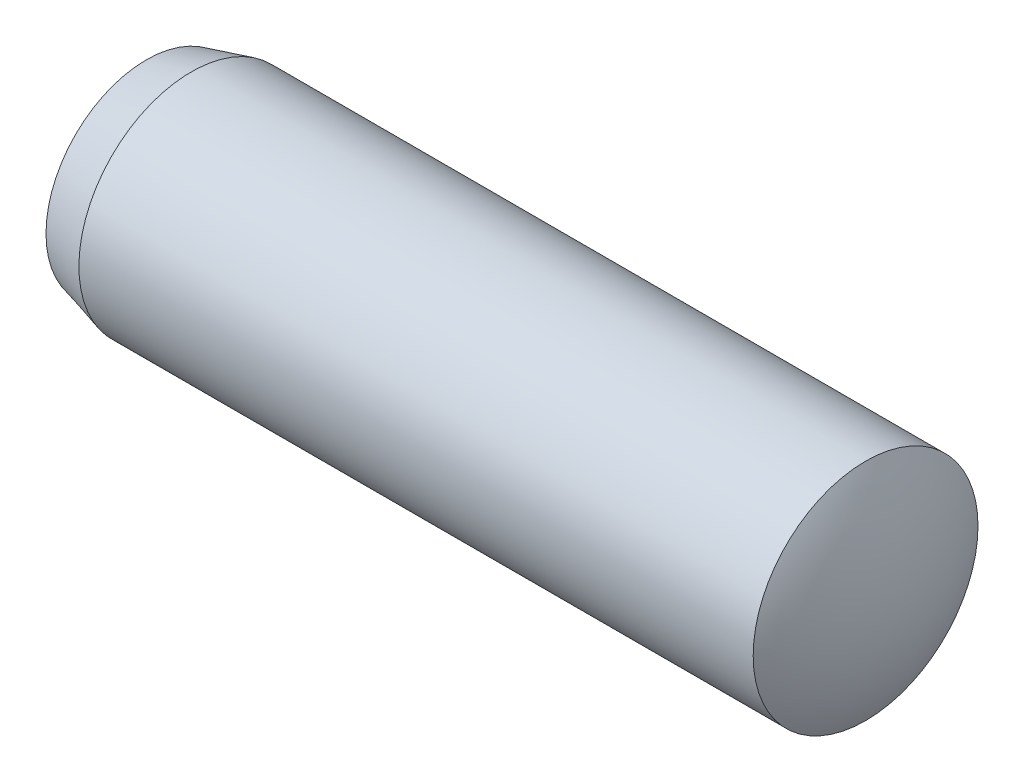
from build123d import *


with BuildPart() as part:
    # Skica1 → Otočit kolem osy1 (revolve)
    with BuildSketch(Plane.XY, mode=Mode.PRIVATE) as oto_it_kolem_osy1_sk:
        with BuildLine():
            Line((0, 0), (0, 0.267846097))
            Line((0, 0.267846097), (0.12, 0.3))
            Line((0.12, 0.3), (1.919615242, 0.3))
            ThreePointArc((1.919615242, 0.3), (1.979555496, 0.155291427), (2, 0))
            Line((2, 0), (0, 0))
        make_face()
    revolve(oto_it_kolem_osy1_sk.sketch.rotate(Axis((0, 0, 0), (1, 0, 0)), 180), axis=Axis((0, 0, 0), (1, 0, 0)))


solid = part.part
